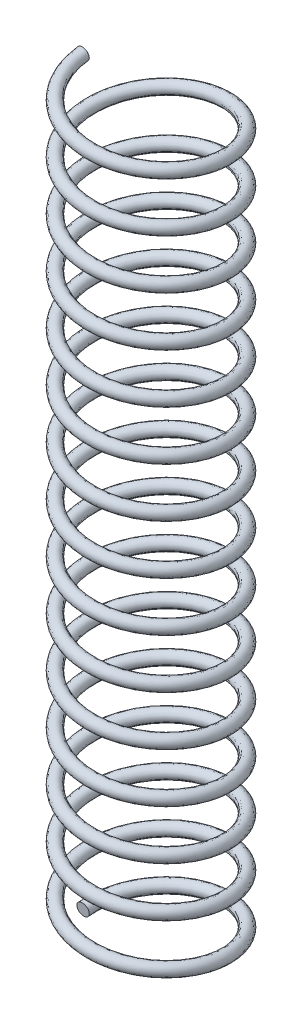
from build123d import *

# Parameters (mm, degrees)
SWEEP1_PITCH       = 2
SWEEP1_HEIGHT      = 30
SWEEP1_RADIUS      = 2.75
SWEEP1_START_ANGLE = -90
SWEEP1_PROFILE_R   = 0.25


with BuildPart() as part:
    # Sweep1: sweep along a helix
    with BuildLine() as sweep1_path:
        add(Helix(SWEEP1_PITCH, SWEEP1_HEIGHT, SWEEP1_RADIUS, center=(0, 0, 0), direction=(0, 1, 0), lefthand=True, mode=Mode.PRIVATE).rotate(Axis((0, 0, 0), (0, 1, 0)), SWEEP1_START_ANGLE))
    # Sweep1 profile (on start of the path) → Sweep1 (sweep)
    with BuildSketch(Plane(origin=(-2.75, 0, 0), x_dir=(0, -0.9933676492470961, -0.11498136122562772), z_dir=(3.168231314705695e-14, 0.11498136122562772, -0.9933676492470961))):
        Circle(SWEEP1_PROFILE_R)
    sweep(path=sweep1_path.line, is_frenet=True)


solid = part.part
